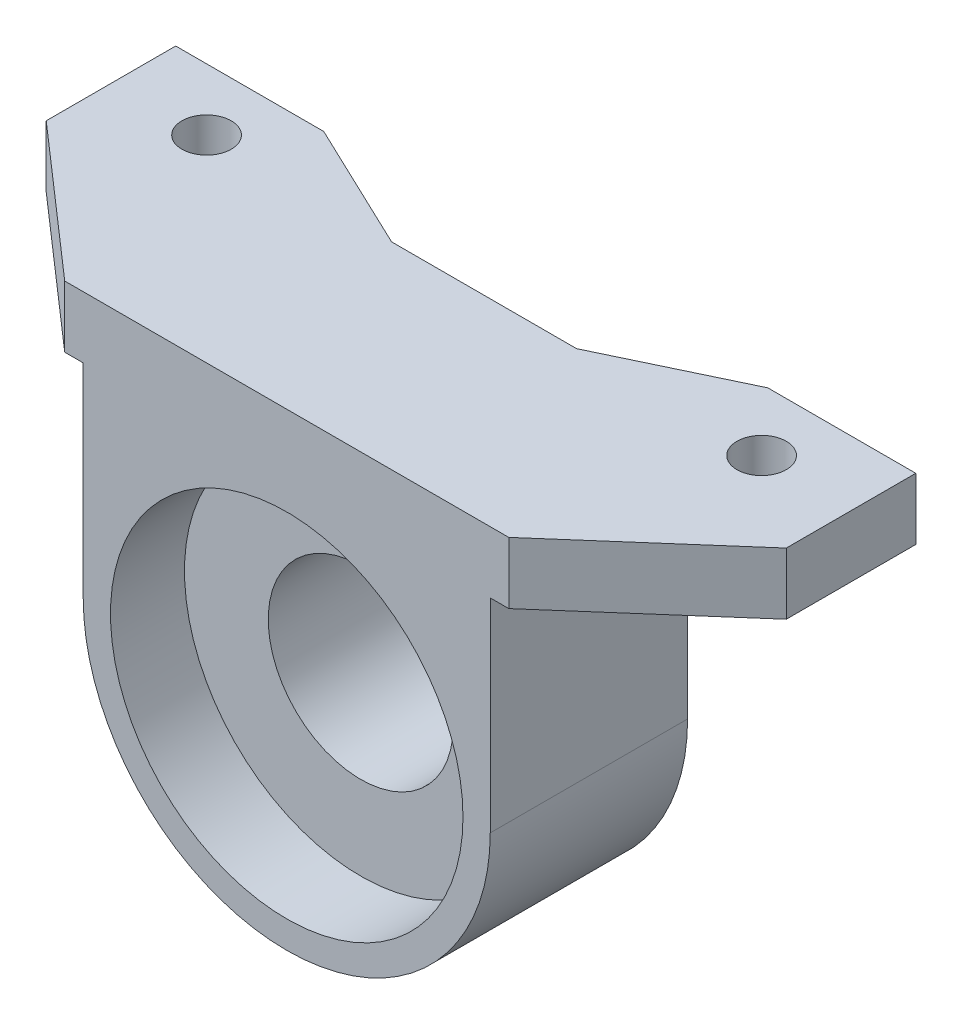
from build123d import *

# Parameters (mm, degrees)
ESQUISSE1_R             = 16.5
ESQUISSE1_R_2           = 14.29
BOSS_EXTRU_1_DEPTH      = 6
BOSS_EXTRU_2_START      = 10
ESQUISSE2_R             = 16.5
BOSS_EXTRU_2_DEPTH      = 10
BOSS_EXTRU_3_DEPTH      = 5
BOSS_EXTRU_4_DEPTH      = 16
ESQUISSE7_R             = 2
ESQUISSE7_W             = 60
ESQUISSE7_H             = 4
ENL_V_MAT_EXTRU_1_DEPTH = 57.071383076
ESQUISSE8_R             = 7.5
ENL_V_MAT_EXTRU_2_DEPTH = 39.23937761
ESQUISSE10_W            = 60
ESQUISSE10_H            = 5
BOSS_EXTRU_5_DEPTH      = 5
ESQUISSE11_W            = 15
ESQUISSE11_H            = 5
ENL_V_MAT_EXTRU_4_DEPTH = 5


with BuildPart() as part:
    # Esquisse1 → Boss.-Extru.1 (new body)
    with BuildSketch(Plane.XY):
        Circle(ESQUISSE1_R)
        Circle(ESQUISSE1_R_2, mode=Mode.SUBTRACT)
    extrude(amount=BOSS_EXTRU_1_DEPTH)

    # Esquisse2 → Boss.-Extru.2 (add)
    with BuildSketch(Plane(origin=(0, 0, 0), x_dir=(-1, 0, 0), z_dir=(0, 0, -1)).offset(BOSS_EXTRU_2_START)):
        Circle(ESQUISSE2_R)
    extrude(amount=-BOSS_EXTRU_2_DEPTH)



with BuildPart() as body_2:
    # Esquisse3 → Boss.-Extru.3 (new body)
    with BuildSketch(Plane(origin=(0, 16.5, 0), x_dir=(1, 0, 0), z_dir=(0, 1, 0))):
        Polygon((0, 10), (40, 10), (40, -10), (0, -10), (-40, -10), (-40, 10), align=None)
    extrude(amount=BOSS_EXTRU_3_DEPTH)


with BuildPart() as part_1:
    add(part.part)

    add(body_2.part)  # Boss.-Extru.4 merges body 2
    # Esquisse4 → Boss.-Extru.4 (add)
    with BuildSketch(Plane.XY.offset(-10)):
        with BuildLine():
            ThreePointArc((-16.5, 0), (-11.66726189, 11.66726189), (0, 16.5))
            Line((0, 16.5), (-16.5, 16.5))
            Line((-16.5, 16.5), (-16.5, 0))
        make_face()
        with BuildLine():
            ThreePointArc((16.5, 0), (11.66726189, 11.66726189), (0, 16.5))
            Line((0, 16.5), (16.5, 16.5))
            Line((16.5, 16.5), (16.5, 0))
        make_face()
    extrude(amount=BOSS_EXTRU_4_DEPTH)

    # Esquisse7 → Enlèv. mat.-Extru.1 (cut, through all)
    with BuildSketch(Plane(origin=(0, 21.5, 0), x_dir=(1, 0, 0), z_dir=(0, 1, 0))):
        Polygon((-40, -10), (-30, -10), (-30, -6), (-30, 10), (-40, 10), align=None)
        Polygon((30, -6), (30, -10), (40, -10), (40, 10), (30, 10), align=None)
        with Locations((22.5, 10)):
            Circle(ESQUISSE7_R)
        with Locations((-22.5, 10)):
            Circle(ESQUISSE7_R)
        with Locations((0, -8)):
            Rectangle(ESQUISSE7_W, ESQUISSE7_H)
    extrude(amount=-ENL_V_MAT_EXTRU_1_DEPTH, mode=Mode.SUBTRACT)

    # Esquisse8 → Enlèv. mat.-Extru.2 (cut, through all)
    with BuildSketch(Plane.XY):
        Circle(ESQUISSE8_R)
    extrude(amount=-ENL_V_MAT_EXTRU_2_DEPTH, mode=Mode.SUBTRACT)

    # Esquisse10 → Boss.-Extru.5 (add)
    with BuildSketch(Plane(origin=(0, 0, -10), x_dir=(-1, 0, 0), z_dir=(0, 0, -1))):
        with Locations((0, 19)):
            Rectangle(ESQUISSE10_W, ESQUISSE10_H)
    extrude(amount=BOSS_EXTRU_5_DEPTH)

    # Esquisse11 → Enlèv. mat.-Extru.4 (cut)
    with BuildSketch(Plane(origin=(0, 21.5, 0), x_dir=(1, 0, 0), z_dir=(0, 1, 0))):
        Polygon((-18, -6), (-30, 4.5), (-30, -6), align=None)
        Polygon((30, 4.5), (18, -6), (30, -6), align=None)
        with BuildLine():
            Line((20.5, 10), (24.5, 10))
            ThreePointArc((24.5, 10), (22.5, 12), (20.5, 10))
        make_face()
        with BuildLine():
            ThreePointArc((20.5, 10), (22.5, 8), (24.5, 10))
            Line((24.5, 10), (20.5, 10))
        make_face()
        with BuildLine():
            Line((-24.5, 10), (-20.5, 10))
            ThreePointArc((-20.5, 10), (-22.5, 12), (-24.5, 10))
        make_face()
        with BuildLine():
            ThreePointArc((-24.5, 10), (-22.5, 8), (-20.5, 10))
            Line((-20.5, 10), (-24.5, 10))
        make_face()
        Polygon((-7.5, 15), (-18, 15), (-7.5, 10), align=None)
        with Locations((0, 12.5)):
            Rectangle(ESQUISSE11_W, ESQUISSE11_H)
        Polygon((7.5, 10), (18, 15), (7.5, 15), align=None)
    extrude(amount=-ENL_V_MAT_EXTRU_4_DEPTH, mode=Mode.SUBTRACT)


solid = part_1.part
